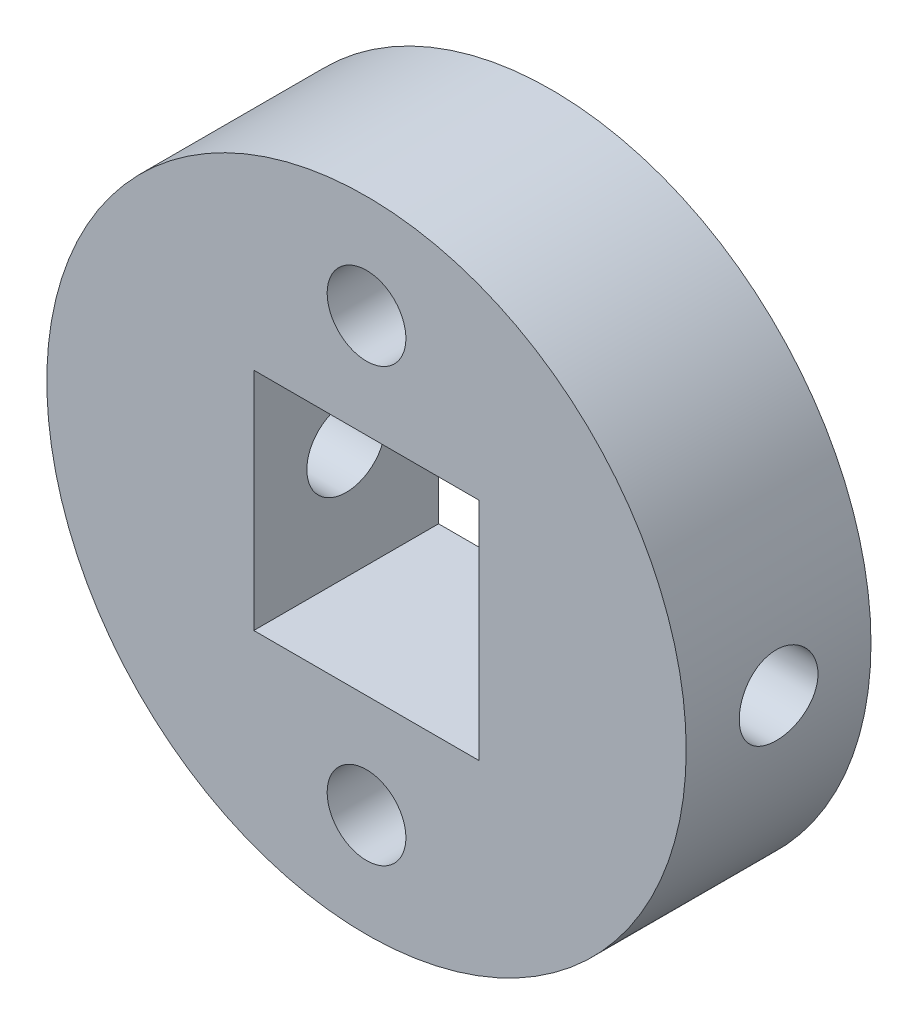
from build123d import *

# Parameters (mm, degrees)
SKETCH1_R                           = 10.9855
SKETCH1_W                           = 7.747
SKETCH1_H                           = 7.747
BOSS_EXTRUDE1_DEPTH                 = 6.35
F_6_32_TAPPED_HOLE1_D               = 2.7051
F_6_32_TAPPED_HOLE1_DEPTH           = 7.112
F_6_32_TAPPED_HOLE1_ON_FACE_2_D     = 2.7051
F_6_32_TAPPED_HOLE1_ON_FACE_2_DEPTH = 7.112
F_6_32_TAPPED_HOLE2_D               = 2.7051
F_6_32_TAPPED_HOLE4_D               = 2.7051


with BuildPart() as part:
    # Sketch1 → Boss-Extrude1 (new body)
    with BuildSketch(Plane.XY):
        Circle(SKETCH1_R)
        Rectangle(SKETCH1_W, SKETCH1_H, mode=Mode.SUBTRACT)
    extrude(amount=BOSS_EXTRUDE1_DEPTH)

    # #6-32 Tapped Hole1
    with Locations(Plane(origin=(10.9855, 0, 3.175), x_dir=(0, 0, 1), z_dir=(1, 0, 0))):
        with Locations((0, 0)):
            Hole(F_6_32_TAPPED_HOLE1_D / 2, depth=F_6_32_TAPPED_HOLE1_DEPTH)

    # #6-32 Tapped Hole1 on face 2
    with Locations(Plane(origin=(3.8735, 0, 3.175), x_dir=(0, 0, -1), z_dir=(-1, 0, 0))):
        with Locations((0, 0)):
            Hole(F_6_32_TAPPED_HOLE1_ON_FACE_2_D / 2, depth=F_6_32_TAPPED_HOLE1_ON_FACE_2_DEPTH)

    # #6-32 Tapped Hole2 (through all)
    with Locations(Plane(origin=(-3.8735, 0, 0), x_dir=(0, 0, -1), z_dir=(1, 0, 0))):
        with Locations((-3.175, 0)):
            Hole(F_6_32_TAPPED_HOLE2_D / 2)

    # #6-32 Tapped Hole4 (through all)
    with Locations(Plane(origin=(0, 0, 0), x_dir=(-1, 0, 0), z_dir=(0, 0, -1))):
        with Locations((0, -7.4295), (0, 7.4295)):
            Hole(F_6_32_TAPPED_HOLE4_D / 2)


solid = part.part
